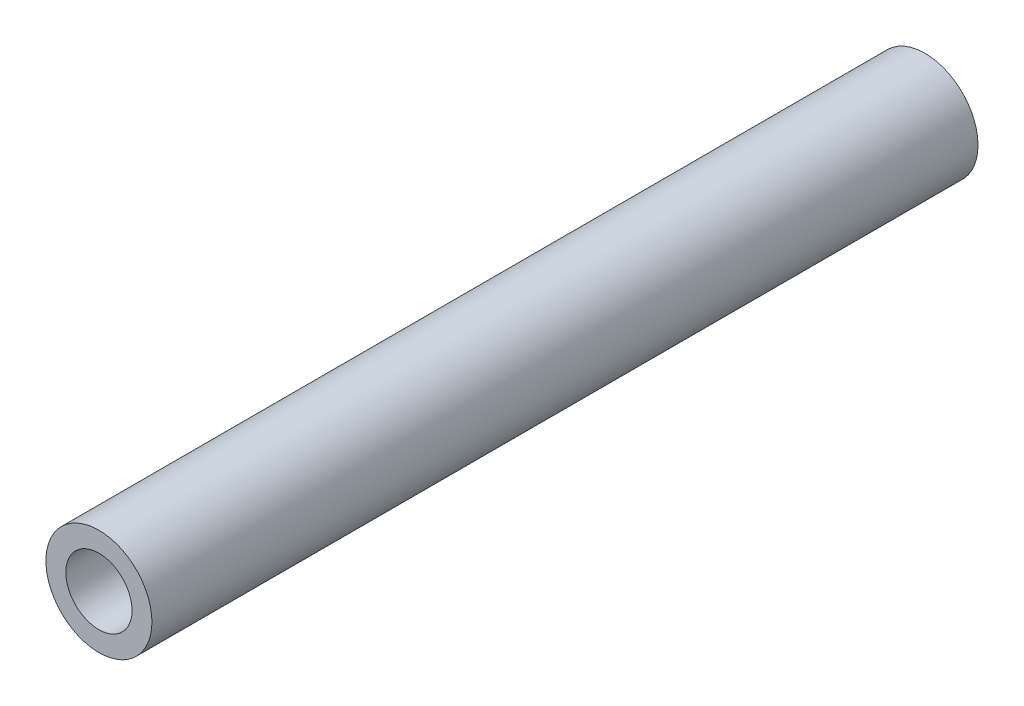
from build123d import *

# Parameters (mm, degrees)
SKETCH1_R           = 12
SKETCH1_R_2         = 7.5
BOSS_EXTRUDE1_DEPTH = 187


with BuildPart() as part:
    # Sketch1 → Boss-Extrude1 (new body)
    with BuildSketch(Plane.XY):
        Circle(SKETCH1_R)
        Circle(SKETCH1_R_2, mode=Mode.SUBTRACT)
    extrude(amount=BOSS_EXTRUDE1_DEPTH)


solid = part.part
